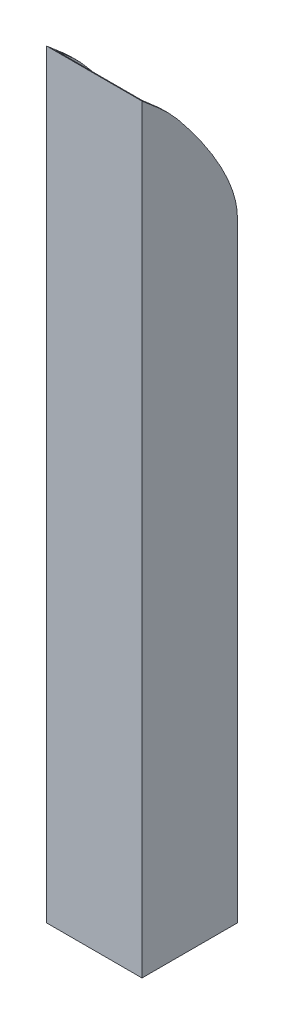
from build123d import *

# Parameters (mm, degrees)
SKETCH2_W           = 25.4
SKETCH2_H           = 25.4
SKETCH2_W_2         = 22.9108
SKETCH2_H_2         = 22.9108
BOSS_EXTRUDE1_DEPTH = 254
CUT_EXTRUDE1_DEPTH  = 256.582569828


with BuildPart() as part:
    # Sketch2 → Boss-Extrude1 (new body)
    with BuildSketch(Plane(origin=(0, 0, 0), x_dir=(1, 0, 0), z_dir=(0, 1, 0))):
        Rectangle(SKETCH2_W, SKETCH2_H)
        Rectangle(SKETCH2_W_2, SKETCH2_H_2, mode=Mode.SUBTRACT)
    extrude(amount=BOSS_EXTRUDE1_DEPTH)

    # Sketch3 → Cut-Extrude1 (cut, through all)
    with BuildSketch(Plane(origin=(12.7, 0, 0), x_dir=(0, 0, -1), z_dir=(1, 0, 0))):
        with BuildLine():
            Line((-68.276407378, 258.068818761), (34.476129628, 258.068818761))
            Line((34.476129628, 258.068818761), (34.476129628, 162.56))
            Line((34.476129628, 162.56), (12.7, 162.56))
            add(Edge.make_bspline(
                [(12.7, 162.56), (12.7, 171.263138251), (-14.036963143, 210.439854493), (-6.819168743, 191.724871957), (-68.276407378, 258.068818761)],
                knots=[0, 0, 0, 0, 0.291427633, 1, 1, 1, 1], degree=3))
        make_face()
    extrude(amount=-CUT_EXTRUDE1_DEPTH, mode=Mode.SUBTRACT)


solid = part.part
